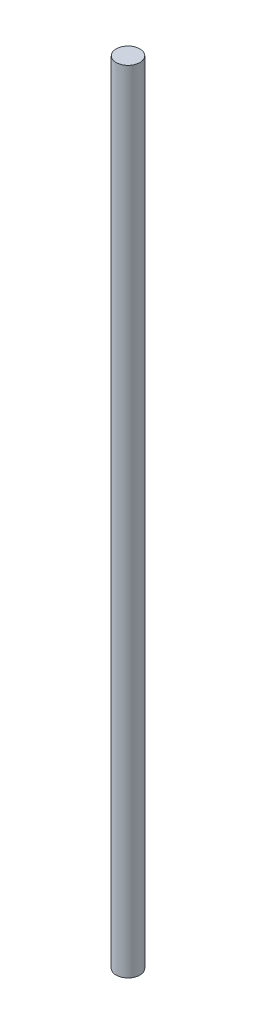
from build123d import *

# Parameters (mm, degrees)
SKETCH1_R           = 3
BOSS_EXTRUDE1_DEPTH = 200


with BuildPart() as part:
    # Sketch1 → Boss-Extrude1 (new body)
    with BuildSketch(Plane(origin=(0, 0, 0), x_dir=(1, 0, 0), z_dir=(0, 1, 0))):
        with Locations(Location((0, -1.604608687, 0), (0, 0, 270))):
            Circle(SKETCH1_R)
    extrude(amount=BOSS_EXTRUDE1_DEPTH)


solid = part.part
